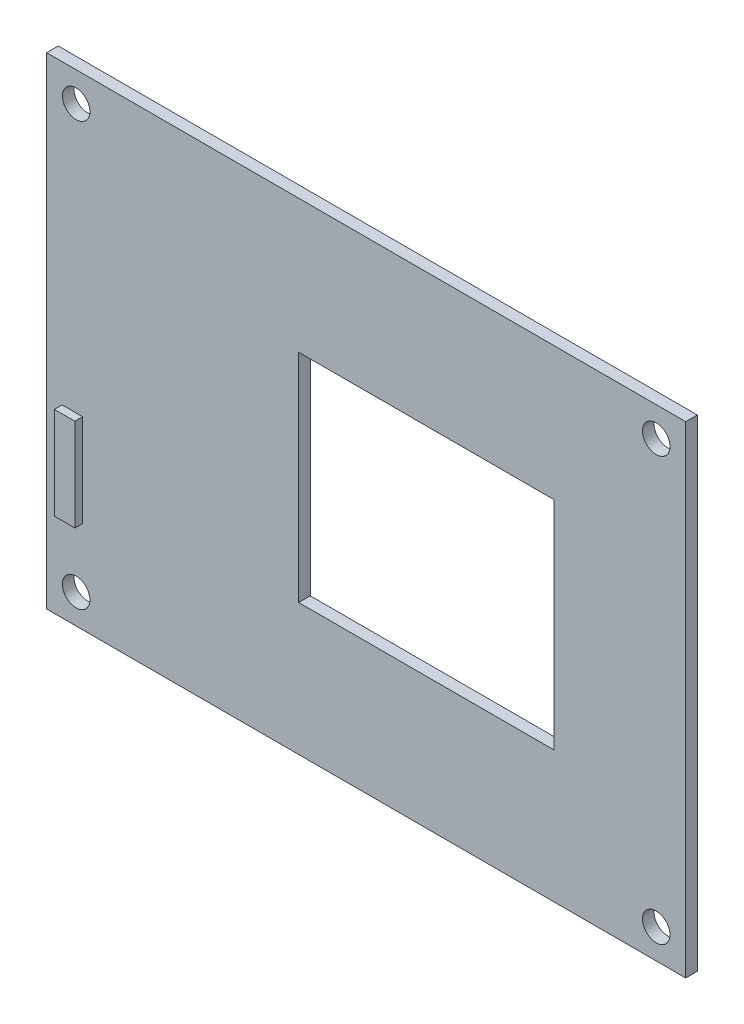
from build123d import *

# Parameters (mm, degrees)
SKETCH1_W           = 82.55
SKETCH1_H           = 62.23
SKETCH1_R           = 1.778
SKETCH1_W_2         = 33
SKETCH1_H_2         = 28
BOSS_EXTRUDE1_DEPTH = 1.5
SKETCH2_W           = 2.642806411
SKETCH2_H           = 11.945484976
BOSS_EXTRUDE2_DEPTH = 1
SKETCH3_W           = 7.043654848
SKETCH3_H           = 10.402717652
BOSS_EXTRUDE3_DEPTH = 2


with BuildPart() as part:
    # Sketch1 → Boss-Extrude1 (new body)
    with BuildSketch(Plane.XY):
        with Locations((41.275, 31.115)):
            Rectangle(SKETCH1_W, SKETCH1_H)
        with Locations((3.81, 58.42)):
            Circle(SKETCH1_R, mode=Mode.SUBTRACT)
        with Locations((78.74, 58.42)):
            Circle(SKETCH1_R, mode=Mode.SUBTRACT)
        with Locations((78.74, 3.81)):
            Circle(SKETCH1_R, mode=Mode.SUBTRACT)
        with Locations((3.81, 3.81)):
            Circle(SKETCH1_R, mode=Mode.SUBTRACT)
        with Locations((49.05, 31)):
            Rectangle(SKETCH1_W_2, SKETCH1_H_2, mode=Mode.SUBTRACT)
    extrude(amount=BOSS_EXTRUDE1_DEPTH)

    # Sketch2 → Boss-Extrude2 (add)
    with BuildSketch(Plane.XY.offset(1.5)):
        with Locations((3.321403206, 17.857601098)):
            Rectangle(SKETCH2_W, SKETCH2_H)
    extrude(amount=BOSS_EXTRUDE2_DEPTH)

    # Sketch3 → Boss-Extrude3 (add)
    with BuildSketch(Plane(origin=(0, 0, 0), x_dir=(-1, 0, 0), z_dir=(0, 0, -1))):
        with Locations((-7.521827424, 32.54095227)):
            Rectangle(SKETCH3_W, SKETCH3_H)
    extrude(amount=BOSS_EXTRUDE3_DEPTH)


solid = part.part
